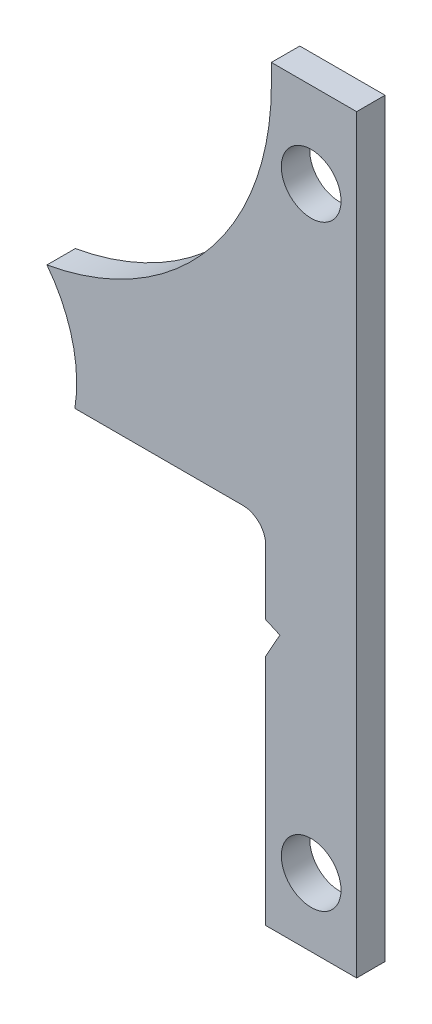
from build123d import *

# Parameters (mm, degrees)
BOSS_EXTRUDE1_DEPTH = 2.5
SKETCH2_R           = 5.25
CUT_EXTRUDE1_DEPTH  = 86.727569626


with BuildPart() as part:
    # Sketch1 → Boss-Extrude1 (new, symmetric)
    with BuildSketch(Plane.XY):
        with BuildLine():
            Line((-49.57019439, -4), (-20, -4))
            ThreePointArc((-20, -4), (-17.171572875, -5.171572875), (-16, -8))
            Line((-16, -8), (-16, -19.403091525))
            Line((-16, -19.403091525), (-13.500700251, -20.50145429))
            Line((-13.500700251, -20.50145429), (-16, -24.97))
            Line((-16, -24.97), (-16, -66))
            Line((-16, -66), (0, -66))
            Line((0, -66), (0, 66))
            Line((0, 66), (-15, 66))
            Line((-15, 66), (-15, 62.56))
            ThreePointArc((-15, 62.56), (-26.17355239, 31.809747222), (-54.481338034, 15.405613876))
            ThreePointArc((-54.481338034, 15.405613876), (-50.022346721, 6.209829337), (-49.57019439, -4))
        make_face()
    extrude(amount=BOSS_EXTRUDE1_DEPTH, both=True)

    # Sketch2 → Cut-Extrude1 (cut, through all)
    with BuildSketch(Plane.XY.offset(2.5)):
        with Locations((-8, 51)):
            Circle(SKETCH2_R)
        with Locations((-8, -54)):
            Circle(SKETCH2_R)
    extrude(amount=-CUT_EXTRUDE1_DEPTH, mode=Mode.SUBTRACT)


solid = part.part
